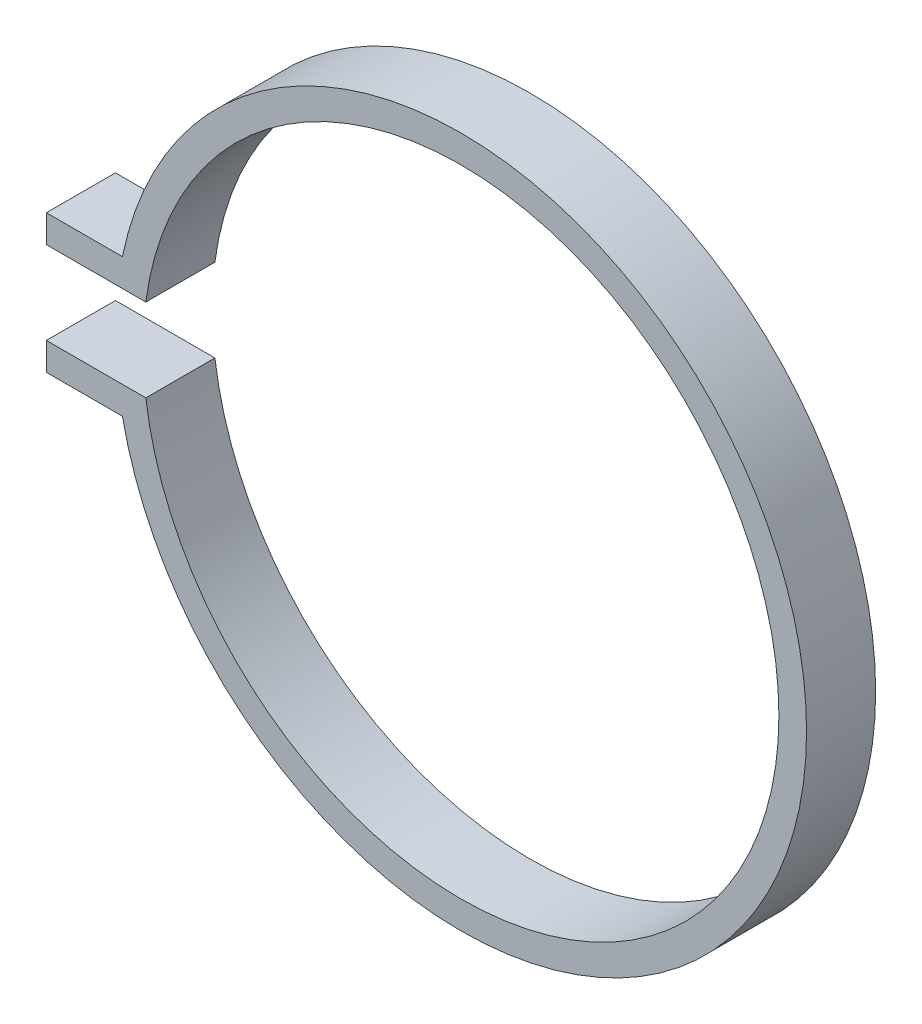
from build123d import *

# Parameters (mm, degrees)
BOSS_EXTRUDE1_DEPTH = 10


with BuildPart() as part:
    # Sketch1 → Boss-Extrude1 (new body)
    with BuildSketch(Plane.XY):
        with BuildLine():
            Line((-60, 10), (-48.989794856, 10))
            ThreePointArc((-48.989794856, 10), (50, 0), (-48.989794856, -10))
            Line((-48.989794856, -10), (-60, -10))
            Line((-60, -10), (-60, -6))
            Line((-60, -6), (-45.607017004, -6))
            ThreePointArc((-45.607017004, -6), (46, 0), (-45.607017004, 6))
            Line((-45.607017004, 6), (-60, 6))
            Line((-60, 6), (-60, 10))
        make_face()
    extrude(amount=BOSS_EXTRUDE1_DEPTH)


solid = part.part
